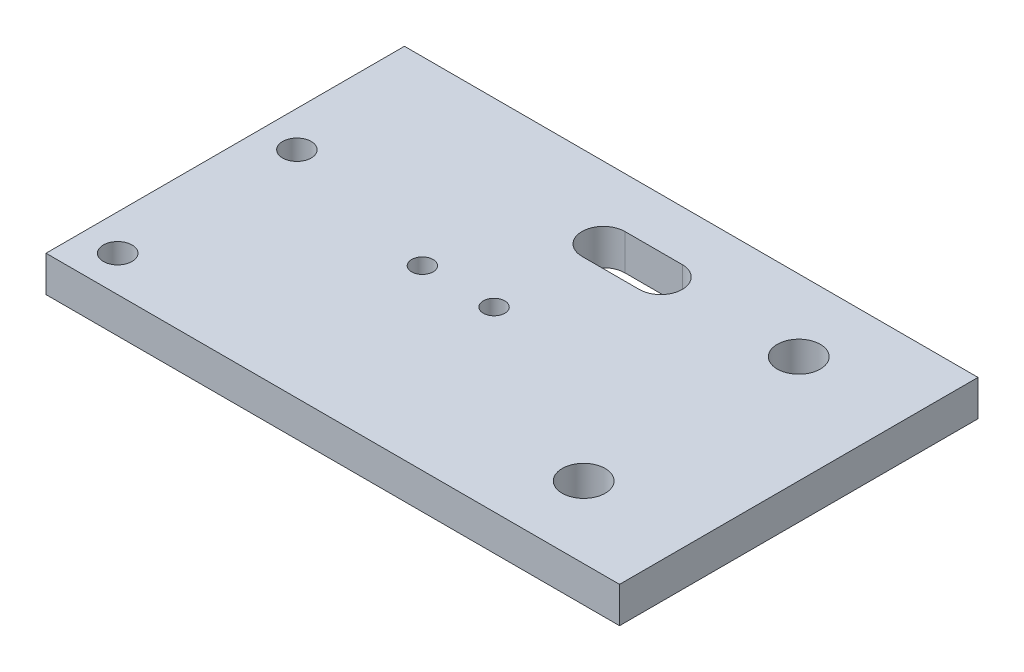
from build123d import *

# Parameters (mm, degrees)
SKETCH1_W           = 80
SKETCH1_H           = 50
SKETCH1_R           = 3
BOSS_EXTRUDE1_DEPTH = 5
CUT_EXTRUDE1_DEPTH  = 5
SKETCH4_R           = 1.5
SKETCH4_R_2         = 2
CUT_EXTRUDE2_DEPTH  = 10


with BuildPart() as part:
    # Sketch1 → Boss-Extrude1 (new body)
    with BuildSketch(Plane(origin=(0, 0, 0), x_dir=(1, 0, 0), z_dir=(0, 1, 0))):
        with Locations((40, 25)):
            Rectangle(SKETCH1_W, SKETCH1_H)
        with Locations(Location((65, 10, 0), (0, 0, 270))):
            Circle(SKETCH1_R, mode=Mode.SUBTRACT)
        with Locations(Location((65, 40, 0), (0, 0, 270))):
            Circle(SKETCH1_R, mode=Mode.SUBTRACT)
    extrude(amount=BOSS_EXTRUDE1_DEPTH)

    # Sketch2 → Cut-Extrude1 (cut)
    with BuildSketch(Plane(origin=(0, 5, 0), x_dir=(1, 0, 0), z_dir=(0, 1, 0))):
        with BuildLine():
            Line((37.752664082, 43), (45.752664082, 43))
            ThreePointArc((45.752664082, 43), (48.752664082, 40), (45.752664082, 37))
            Line((45.752664082, 37), (37.752664082, 37))
            ThreePointArc((37.752664082, 37), (34.752664082, 40), (37.752664082, 43))
        make_face()
    extrude(amount=-CUT_EXTRUDE1_DEPTH, mode=Mode.SUBTRACT)

    # Sketch4 → Cut-Extrude2 (cut)
    with BuildSketch(Plane(origin=(0, 5, 0), x_dir=(1, 0, 0), z_dir=(0, 1, 0))):
        with Locations(Location((37.752664082, 24.743683398, 0), (0, 0, 270))):
            Circle(SKETCH4_R)
        with Locations(Location((27.752664082, 24.743683398, 0), (0, 0, 270))):
            Circle(SKETCH4_R)
        with Locations(Location((5, 30, 0), (0, 0, 270))):
            Circle(SKETCH4_R_2)
        with Locations(Location((5, 5, 0), (0, 0, 270))):
            Circle(SKETCH4_R_2)
    extrude(amount=-CUT_EXTRUDE2_DEPTH, mode=Mode.SUBTRACT)


solid = part.part
